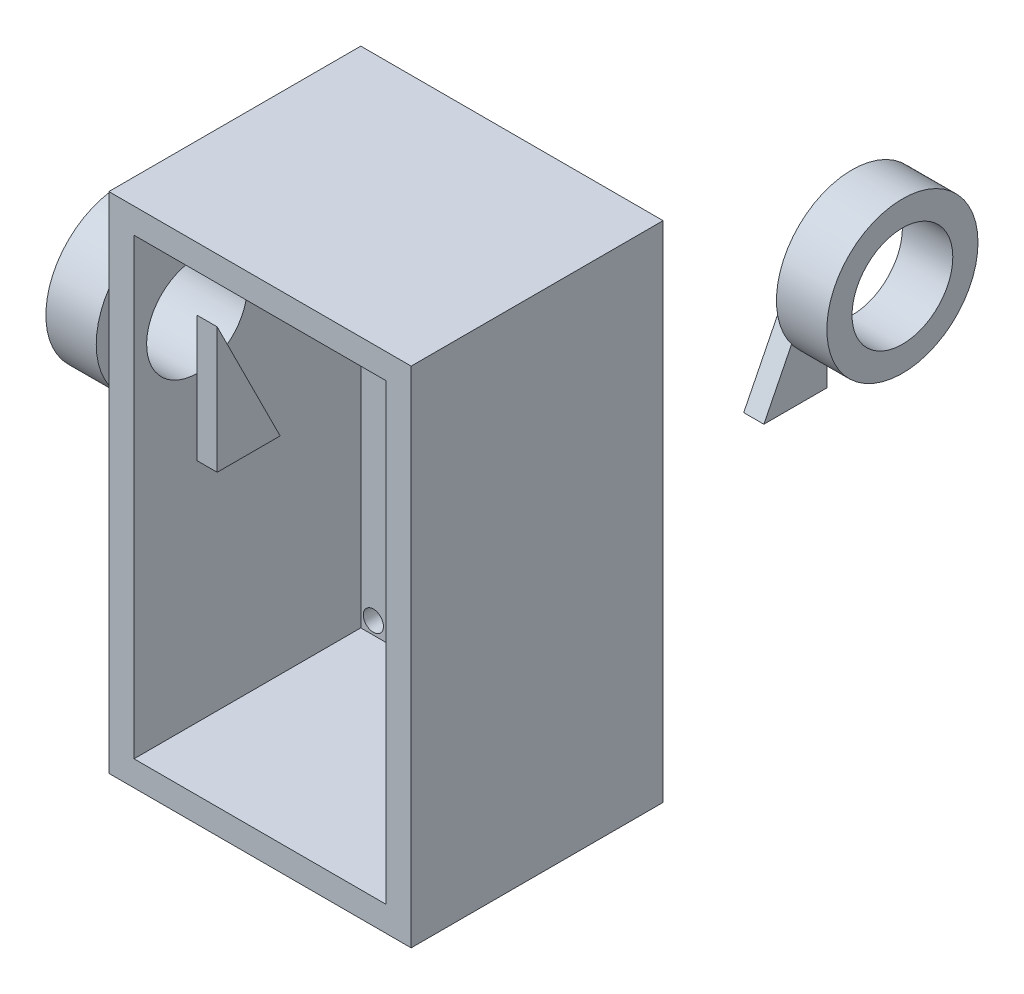
from build123d import *

# Parameters (mm, degrees)
SKETCH1_W           = 120
SKETCH1_H           = 200
BOSS_EXTRUDE1_DEPTH = 100
SKETCH2_W           = 100
SKETCH2_H           = 180
CUT_EXTRUDE1_DEPTH  = 90
SKETCH3_R           = 30
BOSS_EXTRUDE2_DEPTH = 20
SKETCH4_R           = 30
BOSS_EXTRUDE3_DEPTH = 20
SKETCH5_R           = 20
CUT_EXTRUDE2_DEPTH  = 40
SKETCH6_R           = 20
CUT_EXTRUDE3_DEPTH  = 40
BOSS_EXTRUDE4_DEPTH = 8
BOSS_EXTRUDE5_DEPTH = 8
SKETCH9_R           = 4
CUT_EXTRUDE4_DEPTH  = 10


with BuildPart() as part:
    # Sketch1 → Boss-Extrude1 (new body)
    with BuildSketch(Plane.XY):
        Rectangle(SKETCH1_W, SKETCH1_H)
    extrude(amount=BOSS_EXTRUDE1_DEPTH)

    # Sketch2 → Cut-Extrude1 (cut)
    with BuildSketch(Plane.XY.offset(100)):
        Rectangle(SKETCH2_W, SKETCH2_H)
    extrude(amount=-CUT_EXTRUDE1_DEPTH, mode=Mode.SUBTRACT)

    # Sketch3 → Boss-Extrude2 (add)
    with BuildSketch(Plane(origin=(-60, 0, 0), x_dir=(0, 0, -1), z_dir=(1, 0, 0))):
        with Locations((-75, 50)):
            Circle(SKETCH3_R)
    extrude(amount=-BOSS_EXTRUDE2_DEPTH)

    # Sketch5 → Cut-Extrude2 (cut)
    with BuildSketch(Plane(origin=(-80, 0, 0), x_dir=(0, 0, -1), z_dir=(1, 0, 0))):
        with Locations((-75, 50)):
            Circle(SKETCH5_R)
    extrude(amount=CUT_EXTRUDE2_DEPTH, mode=Mode.SUBTRACT)

    # Sketch7 → Boss-Extrude4 (add)
    with BuildSketch(Plane(origin=(-50, 0, 0), x_dir=(0, 0, -1), z_dir=(1, 0, 0))):
        Polygon((-75, 50), (-75, 0), (-50, 0), align=None)
    extrude(amount=BOSS_EXTRUDE4_DEPTH)

    # Sketch9 → Cut-Extrude4 (cut)
    with BuildSketch(Plane.XY):
        with Locations((45, 85)):
            Circle(SKETCH9_R)
        with Locations((-45, 85)):
            Circle(SKETCH9_R)
        with Locations((45, -85)):
            Circle(SKETCH9_R)
        with Locations((-45, -85)):
            Circle(SKETCH9_R)
    extrude(amount=CUT_EXTRUDE4_DEPTH, mode=Mode.SUBTRACT)


with BuildPart() as body_2:
    # Sketch4 → Boss-Extrude3 (new body)
    with BuildSketch(Plane(origin=(60, 0, 0), x_dir=(0, 0, -1), z_dir=(1, 0, 0))):
        with Locations((75, 50)):
            Circle(SKETCH4_R)
    extrude(amount=BOSS_EXTRUDE3_DEPTH)

    # Sketch6 → Cut-Extrude3 (cut)
    with BuildSketch(Plane(origin=(80, 0, 0), x_dir=(0, 0, -1), z_dir=(1, 0, 0))):
        with Locations((75, 50)):
            Circle(SKETCH6_R)
    extrude(amount=-CUT_EXTRUDE3_DEPTH, mode=Mode.SUBTRACT)


with BuildPart() as body_3:
    # Sketch8 → Boss-Extrude5 (new body)
    with BuildSketch(Plane(origin=(50, 0, 0), x_dir=(0, 0, -1), z_dir=(1, 0, 0))):
        Polygon((75, 50), (75, 0), (50, 0), align=None)
    extrude(amount=-BOSS_EXTRUDE5_DEPTH)


solid = Compound([part.part, body_2.part, body_3.part])
